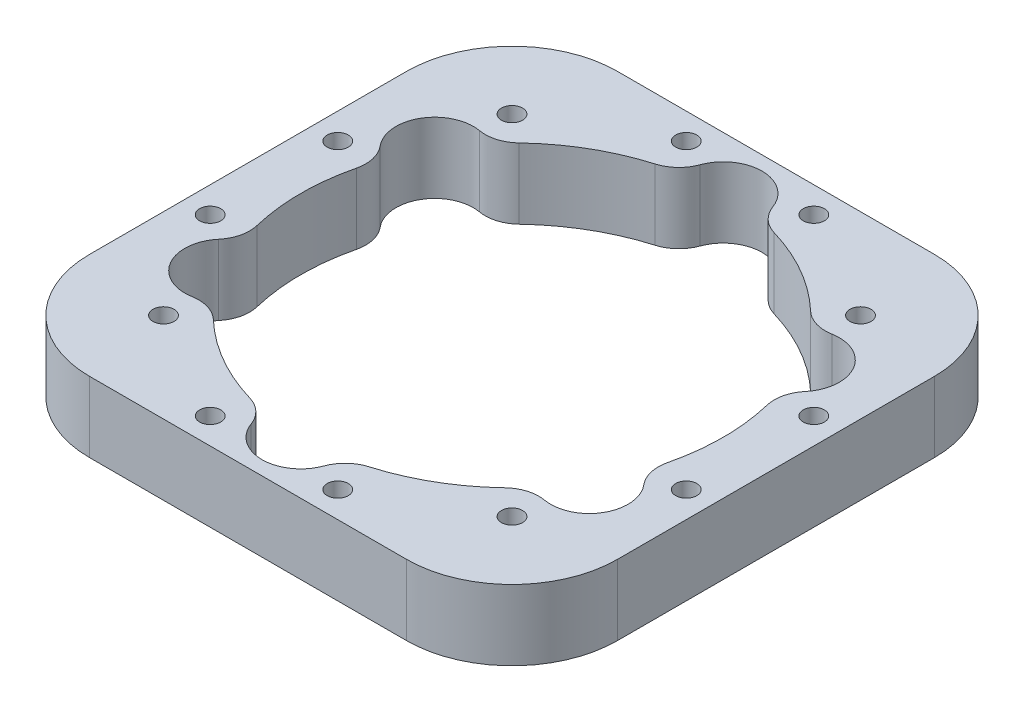
from build123d import *

# Parameters (mm, degrees)
SKETCH1_W           = 75
SKETCH1_H           = 75
SKETCH1_R           = 1.5
BOSS_EXTRUDE1_DEPTH = 10
FILLET1_R           = 5
FILLET2_R           = 15


with BuildPart() as part:
    # Sketch1 → Boss-Extrude1 (new body)
    with BuildSketch(Plane(origin=(0, 0, 0), x_dir=(1, 0, 0), z_dir=(0, 1, 0))):
        Rectangle(SKETCH1_W, SKETCH1_H)
        with Locations(Location((24.748737342, 24.748737342, 0), (0, 0, 270))):
            Circle(SKETCH1_R, mode=Mode.SUBTRACT)
        with Locations(Location((-24.748737342, -24.748737342, 0), (0, 0, 270))):
            Circle(SKETCH1_R, mode=Mode.SUBTRACT)
        with Locations(Location((-9.058666579, -33.80740392, 0), (0, 0, 270))):
            Circle(SKETCH1_R, mode=Mode.SUBTRACT)
        with Locations(Location((-33.80740392, -9.058666579, 0), (0, 0, 270))):
            Circle(SKETCH1_R, mode=Mode.SUBTRACT)
        with Locations(Location((9.058666579, -33.80740392, 0), (0, 0, 270))):
            Circle(SKETCH1_R, mode=Mode.SUBTRACT)
        with Locations(Location((24.748737342, -24.748737342, 0), (0, 0, 270))):
            Circle(SKETCH1_R, mode=Mode.SUBTRACT)
        with Locations(Location((33.80740392, -9.058666579, 0), (0, 0, 270))):
            Circle(SKETCH1_R, mode=Mode.SUBTRACT)
        with Locations(Location((-33.80740392, 9.058666579, 0), (0, 0, 270))):
            Circle(SKETCH1_R, mode=Mode.SUBTRACT)
        with Locations(Location((-24.748737342, 24.748737342, 0), (0, 0, 270))):
            Circle(SKETCH1_R, mode=Mode.SUBTRACT)
        with Locations(Location((-9.058666579, 33.80740392, 0), (0, 0, 270))):
            Circle(SKETCH1_R, mode=Mode.SUBTRACT)
        with BuildLine():
            ThreePointArc((28.282562779, 10.004830964), (30, 0), (28.282562779, -10.004830964))
            ThreePointArc((28.282562779, -10.004830964), (30.743901834, -17.75), (22.805719165, -19.491002369))
            ThreePointArc((22.805719165, -19.491002369), (15, -25.980762114), (5.476843614, -29.495833333))
            ThreePointArc((5.476843614, -29.495833333), (0, -35.5), (-5.476843614, -29.495833333))
            ThreePointArc((-5.476843614, -29.495833333), (-15, -25.980762114), (-22.805719165, -19.491002369))
            ThreePointArc((-22.805719165, -19.491002369), (-30.743901834, -17.75), (-28.282562779, -10.004830964))
            ThreePointArc((-28.282562779, -10.004830964), (-30, 0), (-28.282562779, 10.004830964))
            ThreePointArc((-28.282562779, 10.004830964), (-30.743901834, 17.75), (-22.805719165, 19.491002369))
            ThreePointArc((-22.805719165, 19.491002369), (-15, 25.980762114), (-5.476843614, 29.495833333))
            ThreePointArc((-5.476843614, 29.495833333), (0, 35.5), (5.476843614, 29.495833333))
            ThreePointArc((5.476843614, 29.495833333), (15, 25.980762114), (22.805719165, 19.491002369))
            ThreePointArc((22.805719165, 19.491002369), (30.743901834, 17.75), (28.282562779, 10.004830964))
        make_face(mode=Mode.SUBTRACT)
        with Locations(Location((33.80740392, 9.058666579, 0), (0, 0, 270))):
            Circle(SKETCH1_R, mode=Mode.SUBTRACT)
        with Locations(Location((9.058666579, 33.80740392, 0), (0, 0, 270))):
            Circle(SKETCH1_R, mode=Mode.SUBTRACT)
    extrude(amount=BOSS_EXTRUDE1_DEPTH)

    # Fillet1
    fillet1_edges = [part.edges().sort_by_distance(p)[0] for p in [
        (-28.282562779, 5, -10.004830964),
        (-28.282562779, 5, 10.004830964),
        (-22.805719165, 5, 19.491002369),
        (-5.476843614, 5, 29.495833333),
        (5.476843614, 5, 29.495833333),
        (22.805719165, 5, 19.491002369),
        (28.282562779, 5, 10.004830964),
        (28.282562779, 5, -10.004830964),
        (22.805719165, 5, -19.491002369),
        (5.476843614, 5, -29.495833333),
        (-5.476843614, 5, -29.495833333),
        (-22.805719165, 5, -19.491002369),
    ]]
    fillet(fillet1_edges, radius=FILLET1_R)

    # Fillet2
    fillet2_edges = [part.edges().sort_by_distance(p)[0] for p in [
        (-37.5, 5, -37.5),
        (37.5, 5, -37.5),
        (37.5, 5, 37.5),
        (-37.5, 5, 37.5),
    ]]
    fillet(fillet2_edges, radius=FILLET2_R)


solid = part.part
